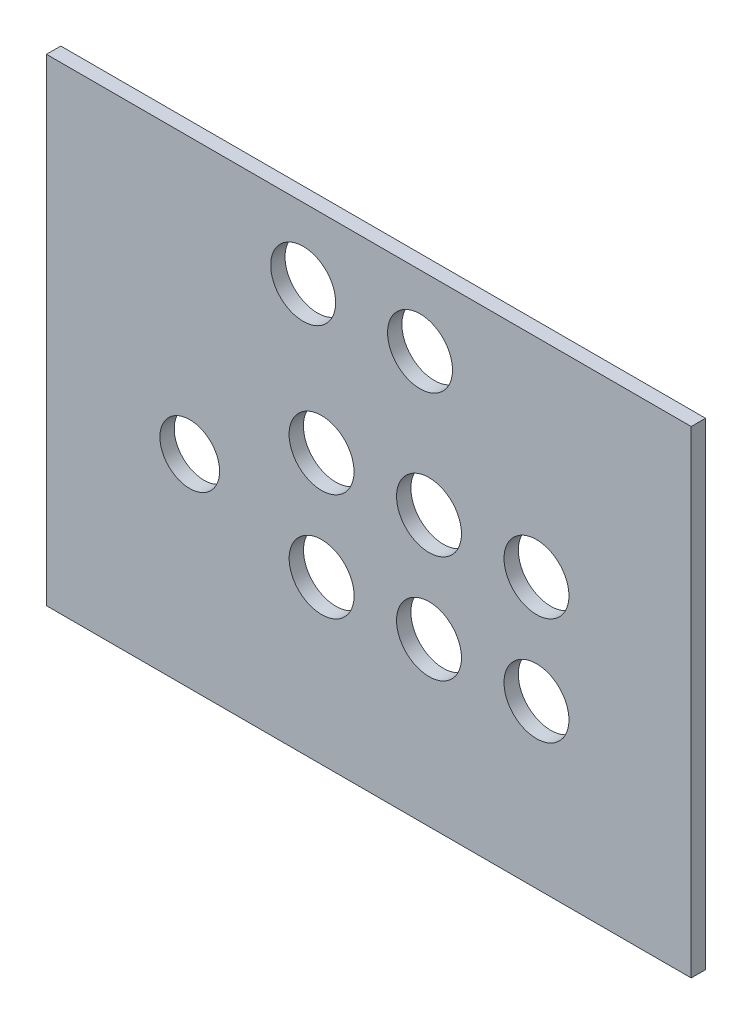
from build123d import *

# Parameters (mm, degrees)
ESBO_O1_W                = 270
ESBO_O1_H                = 200
ESBO_O1_R                = 12.5
ESBO_O1_R_2              = 13.6
RESSALTO_EXTRUS_O1_DEPTH = 6


with BuildPart() as part:
    # Esboço1 → Ressalto-extrusão1 (new body)
    with BuildSketch(Plane.XY):
        with Locations((-135, 100)):
            Rectangle(ESBO_O1_W, ESBO_O1_H)
        with Locations((-210, 85)):
            Circle(ESBO_O1_R, mode=Mode.SUBTRACT)
        with Locations((-154.803247065, 113.000298981)):
            Circle(ESBO_O1_R_2, mode=Mode.SUBTRACT)
        with Locations((-109.803249077, 112.986844303)):
            Circle(ESBO_O1_R_2, mode=Mode.SUBTRACT)
        with Locations((-64.803251, 113)):
            Circle(ESBO_O1_R_2, mode=Mode.SUBTRACT)
        with Locations((-154.774507715, 68.000308159)):
            Circle(ESBO_O1_R_2, mode=Mode.SUBTRACT)
        with Locations((-109.803249077, 68.000274939)):
            Circle(ESBO_O1_R_2, mode=Mode.SUBTRACT)
        with Locations((-64.803251, 68.000274939)):
            Circle(ESBO_O1_R_2, mode=Mode.SUBTRACT)
        with Locations((-162.5, 170.497194253)):
            Circle(ESBO_O1_R_2, mode=Mode.SUBTRACT)
        with Locations((-113.5720157, 170.497194253)):
            Circle(ESBO_O1_R_2, mode=Mode.SUBTRACT)
    extrude(amount=RESSALTO_EXTRUS_O1_DEPTH)


solid = part.part
